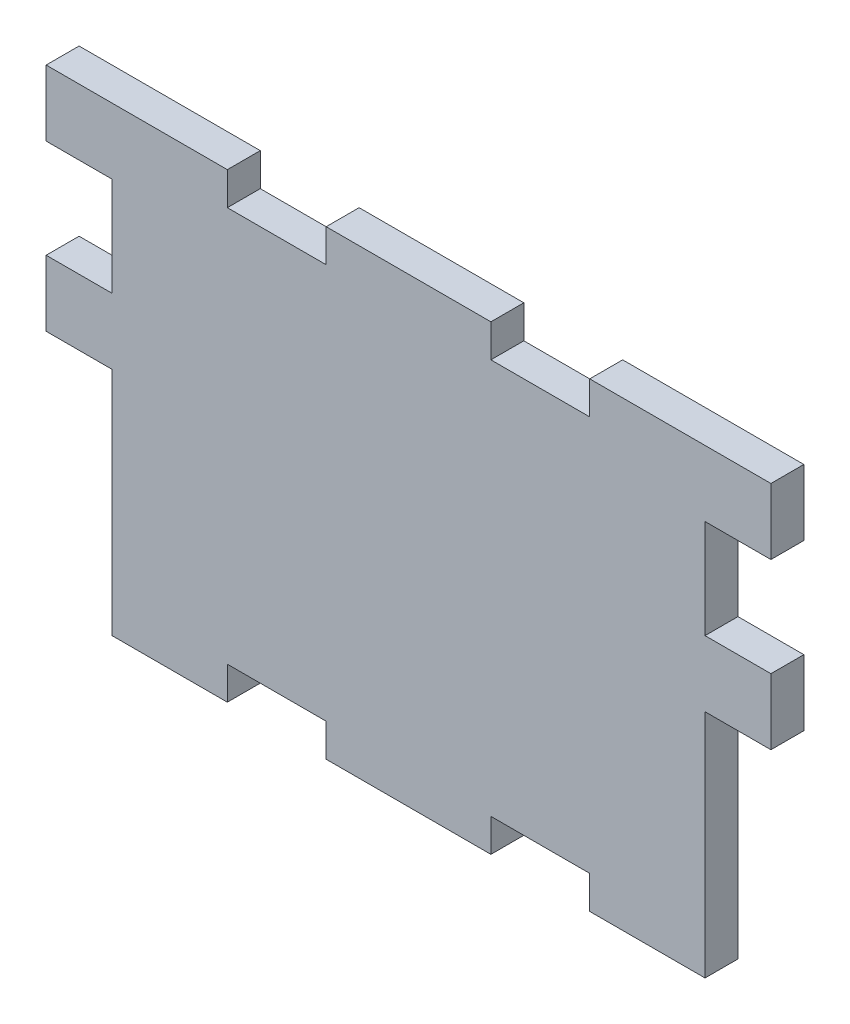
from build123d import *

# Parameters (mm, degrees)
ESQUISSE1_W             = 110
ESQUISSE1_H             = 70
BOSS_EXTRU_1_DEPTH      = 5
ESQUISSE6_W             = 10
ESQUISSE6_H             = 35
ESQUISSE6_H_2           = 15
ESQUISSE6_W_2           = 15
ESQUISSE6_H_3           = 5
ENL_V_MAT_EXTRU_2_DEPTH = 5


with BuildPart() as part:
    # Esquisse1 → Boss.-Extru.1 (new body)
    with BuildSketch(Plane.XY):
        Rectangle(ESQUISSE1_W, ESQUISSE1_H)
    extrude(amount=BOSS_EXTRU_1_DEPTH)

    # Esquisse6 → Enlèv. mat.-Extru.2 (cut)
    with BuildSketch(Plane(origin=(0, 0, 0), x_dir=(-1, 0, 0), z_dir=(0, 0, -1))):
        with Locations((-50, -17.5)):
            Rectangle(ESQUISSE6_W, ESQUISSE6_H)
        with Locations((50, -17.5)):
            Rectangle(ESQUISSE6_W, ESQUISSE6_H)
        with Locations((-50, 17.5)):
            Rectangle(ESQUISSE6_W, ESQUISSE6_H_2)
        with Locations((50, 17.5)):
            Rectangle(ESQUISSE6_W, ESQUISSE6_H_2)
        with Locations((-20, 32.5)):
            Rectangle(ESQUISSE6_W_2, ESQUISSE6_H_3)
        with Locations((20, 32.5)):
            Rectangle(ESQUISSE6_W_2, ESQUISSE6_H_3)
        with Locations((-20, -32.5)):
            Rectangle(ESQUISSE6_W_2, ESQUISSE6_H_3)
        with Locations((20, -32.5)):
            Rectangle(ESQUISSE6_W_2, ESQUISSE6_H_3)
    extrude(amount=-ENL_V_MAT_EXTRU_2_DEPTH, mode=Mode.SUBTRACT)


solid = part.part
